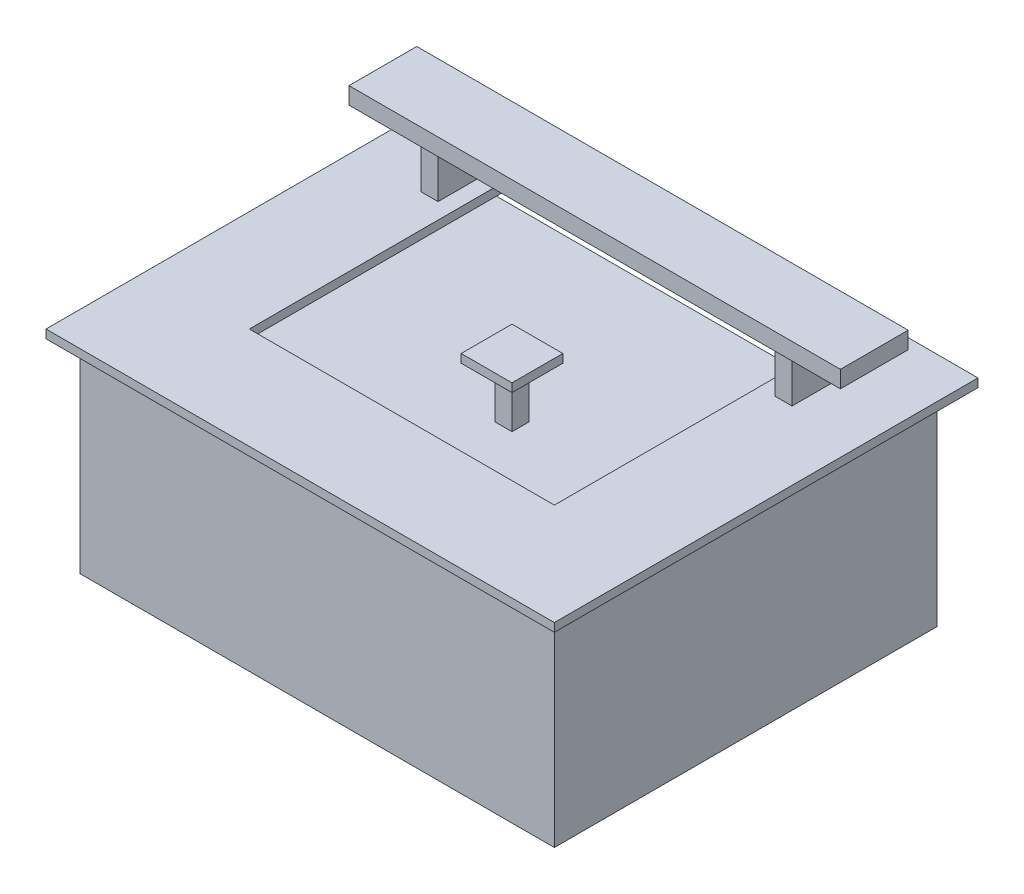
from build123d import *

# Parameters (mm, degrees)
BOSS_EXTRUDE1_DEPTH   = 50
SKETCH1_W             = 300
SKETCH1_H             = 300
BOSS_EXTRUDE1_2_DEPTH = 50
SKETCH2_W             = 100
SKETCH2_H             = 100
BOSS_EXTRUDE2_DEPTH   = 1200
BOSS_EXTRUDE3_REACH   = 3019.035
SKETCH3_W             = 2600
SKETCH3_H             = 100
SKETCH4_W             = 100.752159197
SKETCH4_H             = 260.715900264
BOSS_EXTRUDE4_DEPTH   = 300
SKETCH5_W             = 2900
SKETCH5_H             = 400
BOSS_EXTRUDE5_DEPTH   = 100


with BuildPart() as part:
    # Sketch1 → Boss-Extrude1 (new body)
    with BuildSketch(Plane(origin=(0, 0, 0), x_dir=(1, 0, 0), z_dir=(0, 1, 0))):
        Polygon((-900, 1250), (-900, -650), (900, -650), (900, 1250), (1500, 1250), (1500, -1250), (-1500, -1250), (-1500, 1250), align=None)
    extrude(amount=-BOSS_EXTRUDE1_DEPTH)

    # Sketch2 → Boss-Extrude2 (add)
    with BuildSketch(Plane.XZ.offset(50)):
        Polygon((-1400, 1150), (1400, 1150), (1400, 1050), (1400, -1107.863798508), (1300, -1107.863798508), (1300, 1050), (-1300, 1050), (-1300, -1107.863798508), (-1400, -1107.863798508), (-1400, 1050), align=None)
        Rectangle(SKETCH2_W, SKETCH2_H)
    extrude(amount=BOSS_EXTRUDE2_DEPTH)


with BuildPart() as body_2:
    # Sketch1 → Boss-Extrude1 2 (new body)
    with BuildSketch(Plane(origin=(0, 0, 0), x_dir=(1, 0, 0), z_dir=(0, 1, 0))):
        Rectangle(SKETCH1_W, SKETCH1_H)
    extrude(amount=-BOSS_EXTRUDE1_2_DEPTH)


with BuildPart() as boss_extrude2_piece_1:
    # of the separate pieces the step leaves, piece 1, a body of its own (boss_extrude2_pieces)
    add(part.part.solids().sort_by_distance((-900, 0, -1250))[0])

    # Boss-Extrude3: up to this face of the body (flat: up to its plane)
    boss_extrude3_end = Plane(boss_extrude2_piece_1.part.faces().sort_by_distance((-1350, -650, -1107.863798508))[0])
    # Sketch3 → Boss-Extrude3 (add, up to the picked face)
    with BuildSketch(Plane(origin=(0, 0, 1050), x_dir=(-1, 0, 0), z_dir=(0, 0, -1)), mode=Mode.PRIVATE) as boss_extrude3_sk1:
        with Locations((0, -400)):
            Rectangle(SKETCH3_W, SKETCH3_H)
    boss_extrude3_tool1 = split(extrude(boss_extrude3_sk1.sketch, amount=BOSS_EXTRUDE3_REACH, mode=Mode.PRIVATE), bisect_by=boss_extrude3_end, keep=Keep.BOTH, mode=Mode.PRIVATE)


with BuildPart() as boss_extrude2_piece_2:
    # of the separate pieces the step leaves, piece 2, a body of its own (boss_extrude2_pieces)
    add(part.part.solids().sort_by_distance((50, -50, -50))[0])


with BuildPart() as boss_extrude2_piece_1_1:
    add(boss_extrude2_piece_1.part)

    add(boss_extrude2_piece_2.part)  # Boss-Extrude3 merges Boss-Extrude2 piece 2
    add(boss_extrude3_tool1.solids().sort_by(Axis((0, -400, 1050), (0, 0, -1)))[0])

    # Sketch4 → Boss-Extrude4 (add)
    with BuildSketch(Plane(origin=(0, 0, 0), x_dir=(1, 0, 0), z_dir=(0, 1, 0))):
        with Locations((1044.621190012, 688.056214023)):
            Rectangle(SKETCH4_W, SKETCH4_H)
        with Locations((-1044.621190012, 688.056214023)):
            Rectangle(SKETCH4_W, SKETCH4_H)
    extrude(amount=BOSS_EXTRUDE4_DEPTH)

    # Sketch5 → Boss-Extrude5 (add)
    with BuildSketch(Plane(origin=(0, 300, 0), x_dir=(1, 0, 0), z_dir=(0, 1, 0))):
        with Locations((0, 688.056214023)):
            Rectangle(SKETCH5_W, SKETCH5_H)
    extrude(amount=BOSS_EXTRUDE5_DEPTH)


solid = Compound([body_2.part, boss_extrude2_piece_1_1.part])
